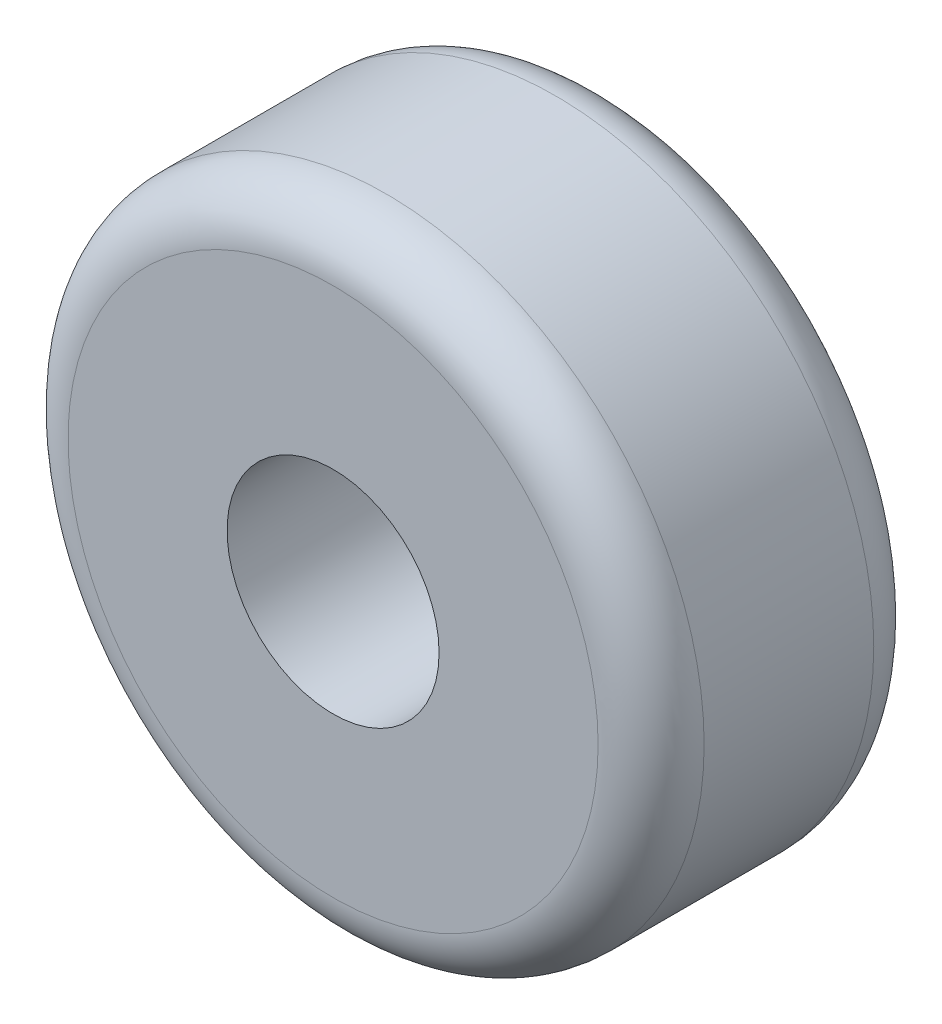
from build123d import *

# Parameters (mm, degrees)
ESQUISSE1_R             = 12
BOSS_EXTRU_1_DEPTH      = 10.4
CONG_1_R                = 2
CONG_2_R                = 2
ESQUISSE2_R             = 4
ENL_V_MAT_EXTRU_1_DEPTH = 10.4


with BuildPart() as part:
    # Esquisse1 → Boss.-Extru.1 (new body)
    with BuildSketch(Plane.XY):
        Circle(ESQUISSE1_R)
    extrude(amount=BOSS_EXTRU_1_DEPTH)

    # Congé1
    cong_1_edges = [part.edges().sort_by_distance(p)[0] for p in [
        (-12, 0, 10.4),
    ]]
    fillet(cong_1_edges, radius=CONG_1_R)

    # Congé2
    cong_2_edges = [part.edges().sort_by_distance(p)[0] for p in [
        (-12, 0, 0),
    ]]
    fillet(cong_2_edges, radius=CONG_2_R)

    # Esquisse2 → Enlèv. mat.-Extru.1 (cut)
    with BuildSketch(Plane.XY):
        Circle(ESQUISSE2_R)
    extrude(amount=ENL_V_MAT_EXTRU_1_DEPTH, mode=Mode.SUBTRACT)


solid = part.part
